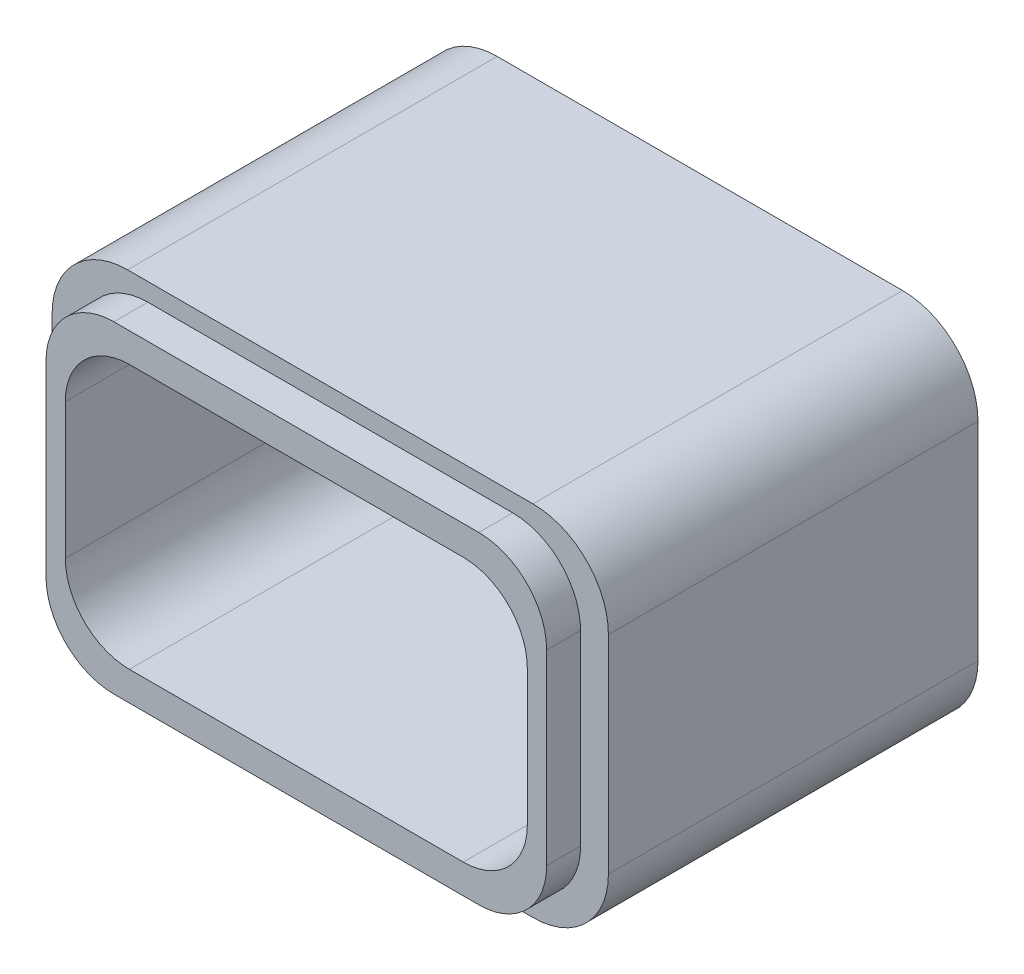
from build123d import *

# Parameters (mm, degrees)
SKETCH2_W           = 37.465
SKETCH2_H           = 24.13
BOSS_EXTRUDE1_DEPTH = 24.892
CUT_EXTRUDE1_DEPTH  = 20.701
CUT_EXTRUDE3_DEPTH  = 4.191
FILLET1_R           = 5.08
BOSS_EXTRUDE3_START = 2.286
BOSS_EXTRUDE3_DEPTH = 2.286
SKETCH8_R           = 1.905
CUT_EXTRUDE4_DEPTH  = 7.62


with BuildPart() as part:
    # Sketch2 → Boss-Extrude1 (new body)
    with BuildSketch(Plane.XY):
        with Locations((18.7325, 12.065)):
            Rectangle(SKETCH2_W, SKETCH2_H)
    extrude(amount=BOSS_EXTRUDE1_DEPTH)

    # Sketch3 → Cut-Extrude1 (cut)
    with BuildSketch(Plane.XY.offset(24.892)):
        with BuildLine():
            ThreePointArc((3.175, 16.637), (4.439712919, 19.690287081), (7.493, 20.955))
            Line((7.493, 20.955), (29.972, 20.955))
            ThreePointArc((29.972, 20.955), (33.025287081, 19.690287081), (34.29, 16.637))
            Line((34.29, 16.637), (34.29, 7.493))
            ThreePointArc((34.29, 7.493), (33.025287081, 4.439712919), (29.972, 3.175))
            Line((29.972, 3.175), (7.493, 3.175))
            ThreePointArc((7.493, 3.175), (4.439712919, 4.439712919), (3.175, 7.493))
            Line((3.175, 7.493), (3.175, 16.637))
        make_face()
    extrude(amount=-CUT_EXTRUDE1_DEPTH, mode=Mode.SUBTRACT)

    # Sketch4 → Cut-Extrude3 (cut)
    with BuildSketch(Plane.XY.offset(4.191)):
        with BuildLine():
            Line((32.086974483, 8.570131), (32.07077796, 10.882539488))
            add(Edge.make_bspline(
                [(32.07077796, 10.882539488), (32.073215089, 11.03512727), (32.05346317, 11.384531492), (31.98348624, 11.89897185), (31.690265244, 12.891461502), (30.781603575, 14.240804474), (29.41900903, 15.119220909), (28.414706523, 15.393168176), (27.909381539, 15.452204781), (27.554769457, 15.464756938), (27.429691001, 15.46229384)],
                knots=[0, 0, 0, 0.046875, 0.09375, 0.1875, 0.375, 0.625, 0.8125, 0.90625, 0.953125, 1, 1, 1], degree=2))
            Line((27.429691001, 15.46229384), (21.587714207, 15.44582783))
            add(Edge.make_bspline(
                [(21.587714207, 15.44582783), (21.462803996, 15.448731855), (21.106730304, 15.437338634), (20.595765352, 15.378996632), (19.591692577, 15.107051395), (18.225687665, 14.229774678), (17.316214622, 12.885953496), (17.020022679, 11.889285009), (16.949885556, 11.382167163), (16.92906595, 11.034797324), (16.930958193, 10.882006896)],
                knots=[0, 0, 0, 0.046875, 0.09375, 0.1875, 0.375, 0.625, 0.8125, 0.90625, 0.953125, 1, 1, 1], degree=2))
            Line((16.930958193, 10.882006896), (16.947147256, 8.570663591))
            add(Edge.make_bspline(
                [(16.947147256, 8.570663591), (16.944692803, 8.418076087), (16.96440505, 8.068669624), (17.034323571, 7.554221325), (17.32743188, 6.561698387), (18.235940341, 5.212252256), (19.598435143, 4.33368112), (20.60270654, 4.059619828), (21.108024818, 4.00052585), (21.462635472, 3.98793343), (21.587714207, 3.990382327)],
                knots=[0, 0, 0, 0.046875, 0.09375, 0.1875, 0.375, 0.625, 0.8125, 0.90625, 0.953125, 1, 1, 1], degree=2))
            Line((21.587714207, 3.990382327), (27.429691002, 4.006848338))
            add(Edge.make_bspline(
                [(27.429691002, 4.006848338), (27.554600877, 4.003929875), (27.910675883, 4.015281941), (28.421647575, 4.073564883), (29.425751775, 4.345394065), (30.791858076, 5.22251289), (31.701486436, 6.566228943), (31.997793574, 7.562863188), (32.067989311, 8.069972924), (32.088849066, 8.417340355), (32.086974483, 8.570131)],
                knots=[0, 0, 0, 0.046875, 0.09375, 0.1875, 0.375, 0.625, 0.8125, 0.90625, 0.953125, 1, 1, 1], degree=2))
        make_face()
    extrude(amount=-CUT_EXTRUDE3_DEPTH, mode=Mode.SUBTRACT)

    # Fillet1
    fillet1_edges = [part.edges().sort_by_distance(p)[0] for p in [
        (0, 24.13, 12.446),
        (37.465, 24.13, 12.446),
        (37.465, 0, 12.446),
        (0, 0, 12.446),
    ]]
    fillet(fillet1_edges, radius=FILLET1_R)

    # Sketch7 → Boss-Extrude3 (add)
    with BuildSketch(Plane.XY.offset(24.892).offset(BOSS_EXTRUDE3_START)):
        with BuildLine():
            Line((6.44525, 1.2065), (31.01975, 1.2065))
            ThreePointArc((31.01975, 1.2065), (34.252642204, 2.545607796), (35.59175, 5.7785))
            Line((35.59175, 5.7785), (35.59175, 18.3515))
            ThreePointArc((35.59175, 18.3515), (34.252642204, 21.584392204), (31.01975, 22.9235))
            Line((31.01975, 22.9235), (6.44525, 22.9235))
            ThreePointArc((6.44525, 22.9235), (3.212357796, 21.584392204), (1.87325, 18.3515))
            Line((1.87325, 18.3515), (1.87325, 5.7785))
            ThreePointArc((1.87325, 5.7785), (3.212357796, 2.545607796), (6.44525, 1.2065))
        make_face()
        with BuildLine():
            Line((7.493, 20.955), (29.972, 20.955))
            ThreePointArc((29.972, 20.955), (33.025287081, 19.690287081), (34.29, 16.637))
            Line((34.29, 16.637), (34.29, 7.493))
            ThreePointArc((34.29, 7.493), (33.025287081, 4.439712919), (29.972, 3.175))
            Line((29.972, 3.175), (7.493, 3.175))
            ThreePointArc((7.493, 3.175), (4.439712919, 4.439712919), (3.175, 7.493))
            Line((3.175, 7.493), (3.175, 16.637))
            ThreePointArc((3.175, 16.637), (4.439712919, 19.690287081), (7.493, 20.955))
        make_face(mode=Mode.SUBTRACT)
    extrude(amount=-BOSS_EXTRUDE3_DEPTH)

    # Sketch8 → Cut-Extrude4 (cut)
    with BuildSketch(Plane.ZY):
        with Locations((12.446, 12.065)):
            Circle(SKETCH8_R)
    extrude(amount=-CUT_EXTRUDE4_DEPTH, mode=Mode.SUBTRACT)


solid = part.part
